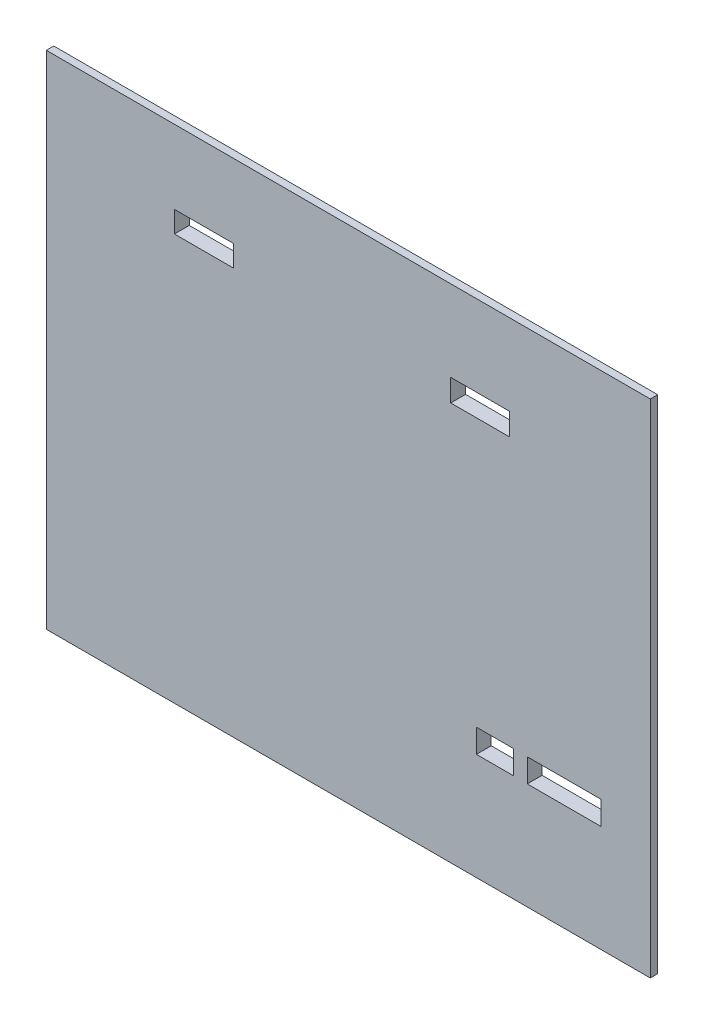
from build123d import *

# Parameters (mm, degrees)
SKETCH1_W           = 122
SKETCH1_H           = 101.3
BOSS_EXTRUDE1_DEPTH = 3
SKETCH2_W           = 1.5
SKETCH2_H           = 2.1
CUT_EXTRUDE2_DEPTH  = 130
SKETCH3_W           = 1.5
SKETCH3_H           = 2.1
CUT_EXTRUDE3_DEPTH  = 123
SKETCH4_W           = 2.1
SKETCH4_H           = 1.5
CUT_EXTRUDE4_DEPTH  = 123
SKETCH5_W           = 2.1
SKETCH5_H           = 1.5
CUT_EXTRUDE5_DEPTH  = 123
SKETCH7_W           = 7.497772187
SKETCH7_H           = 4.759480864
CUT_EXTRUDE6_DEPTH  = 5
SKETCH8_W           = 11.848959364
SKETCH8_H           = 4.476273538
CUT_EXTRUDE7_DEPTH  = 5
SKETCH9_W           = 11.911321609
SKETCH9_H           = 4.308108171
CUT_EXTRUDE8_DEPTH  = 5
SKETCH6_W           = 14.939397766
SKETCH6_H           = 4.753444744
CUT_EXTRUDE9_DEPTH  = 5


with BuildPart() as part:
    # Sketch1 → Boss-Extrude1 (new body)
    with BuildSketch(Plane.XY):
        with Locations((129.5, -82.15)):
            Rectangle(SKETCH1_W, SKETCH1_H)
    extrude(amount=BOSS_EXTRUDE1_DEPTH)

    # Sketch2 → Cut-Extrude2 (cut)
    with BuildSketch(Plane(origin=(190.5, 0, 0), x_dir=(0, 0, -1), z_dir=(1, 0, 0))):
        with Locations((-0.75, -131.75)):
            Rectangle(SKETCH2_W, SKETCH2_H)
    extrude(amount=-CUT_EXTRUDE2_DEPTH, mode=Mode.SUBTRACT)

    # Sketch3 → Cut-Extrude3 (cut)
    with BuildSketch(Plane(origin=(190.5, 0, 0), x_dir=(0, 0, -1), z_dir=(1, 0, 0))):
        with Locations((-0.75, -32.55)):
            Rectangle(SKETCH3_W, SKETCH3_H)
    extrude(amount=-CUT_EXTRUDE3_DEPTH, mode=Mode.SUBTRACT)

    # Sketch4 → Cut-Extrude4 (cut)
    with BuildSketch(Plane(origin=(0, -31.5, 0), x_dir=(1, 0, 0), z_dir=(0, 1, 0))):
        with Locations((69.55, -0.75)):
            Rectangle(SKETCH4_W, SKETCH4_H)
    extrude(amount=-CUT_EXTRUDE4_DEPTH, mode=Mode.SUBTRACT)

    # Sketch5 → Cut-Extrude5 (cut)
    with BuildSketch(Plane(origin=(0, -31.5, 0), x_dir=(1, 0, 0), z_dir=(0, 1, 0))):
        with Locations((189.45, -0.75)):
            Rectangle(SKETCH5_W, SKETCH5_H)
    extrude(amount=-CUT_EXTRUDE5_DEPTH, mode=Mode.SUBTRACT)

    # Sketch7 → Cut-Extrude6 (cut)
    with BuildSketch(Plane.XY.offset(3)):
        with Locations((159.126113906, -108.853990326)):
            Rectangle(SKETCH7_W, SKETCH7_H)
    extrude(amount=-CUT_EXTRUDE6_DEPTH, mode=Mode.SUBTRACT)

    # Sketch8 → Cut-Extrude7 (cut)
    with BuildSketch(Plane.XY.offset(3)):
        with Locations((156.118860553, -50.111595953)):
            Rectangle(SKETCH8_W, SKETCH8_H)
    extrude(amount=-CUT_EXTRUDE7_DEPTH, mode=Mode.SUBTRACT)

    # Sketch9 → Cut-Extrude8 (cut)
    with BuildSketch(Plane.XY.offset(3)):
        with Locations((100.333019396, -48.546030804)):
            Rectangle(SKETCH9_W, SKETCH9_H)
    extrude(amount=-CUT_EXTRUDE8_DEPTH, mode=Mode.SUBTRACT)

    # Sketch6 → Cut-Extrude9 (cut)
    with BuildSketch(Plane.XY.offset(3)):
        with Locations((173.124127973, -108.889085644)):
            Rectangle(SKETCH6_W, SKETCH6_H)
    extrude(amount=-CUT_EXTRUDE9_DEPTH, mode=Mode.SUBTRACT)


solid = part.part
